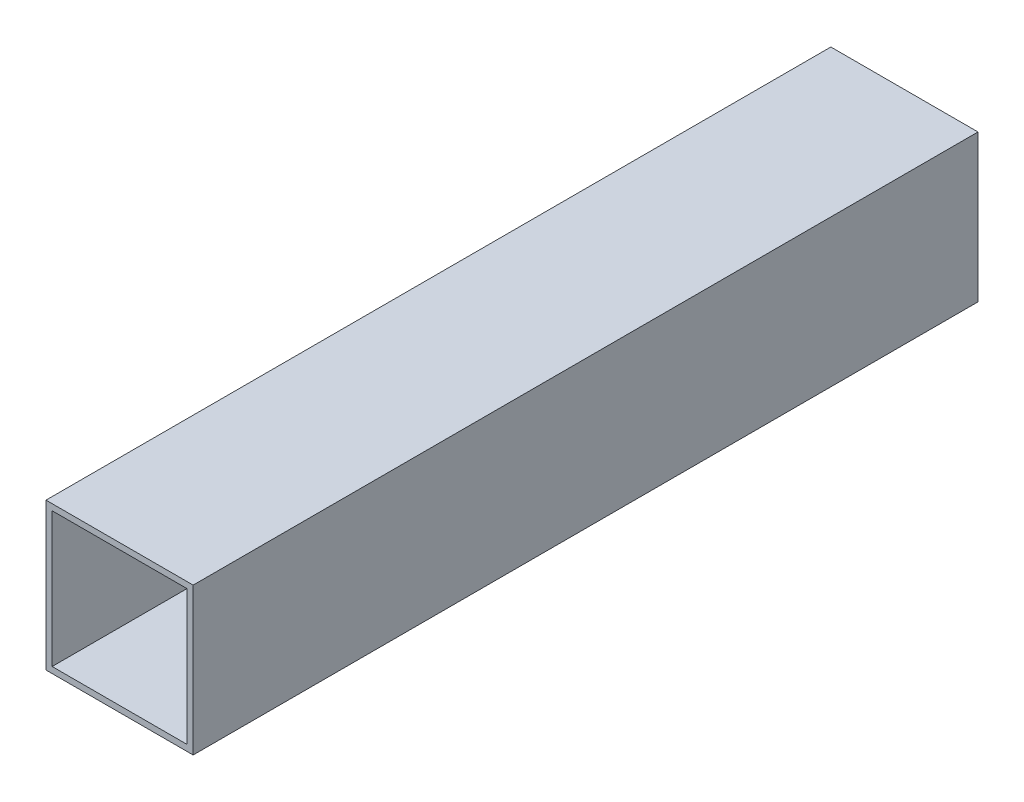
from build123d import *

# Parameters (mm, degrees)
SKETCH2_W           = 38.1
SKETCH2_H           = 38.1
SKETCH2_W_2         = 34.925
SKETCH2_H_2         = 34.925
BOSS_EXTRUDE1_DEPTH = 203.2


with BuildPart() as part:
    # Sketch2 → Boss-Extrude1 (new body)
    with BuildSketch(Plane.XY):
        with Locations((19.05, 19.05)):
            Rectangle(SKETCH2_W, SKETCH2_H)
        with Locations((19.05, 19.05)):
            Rectangle(SKETCH2_W_2, SKETCH2_H_2, mode=Mode.SUBTRACT)
    extrude(amount=BOSS_EXTRUDE1_DEPTH)


solid = part.part
